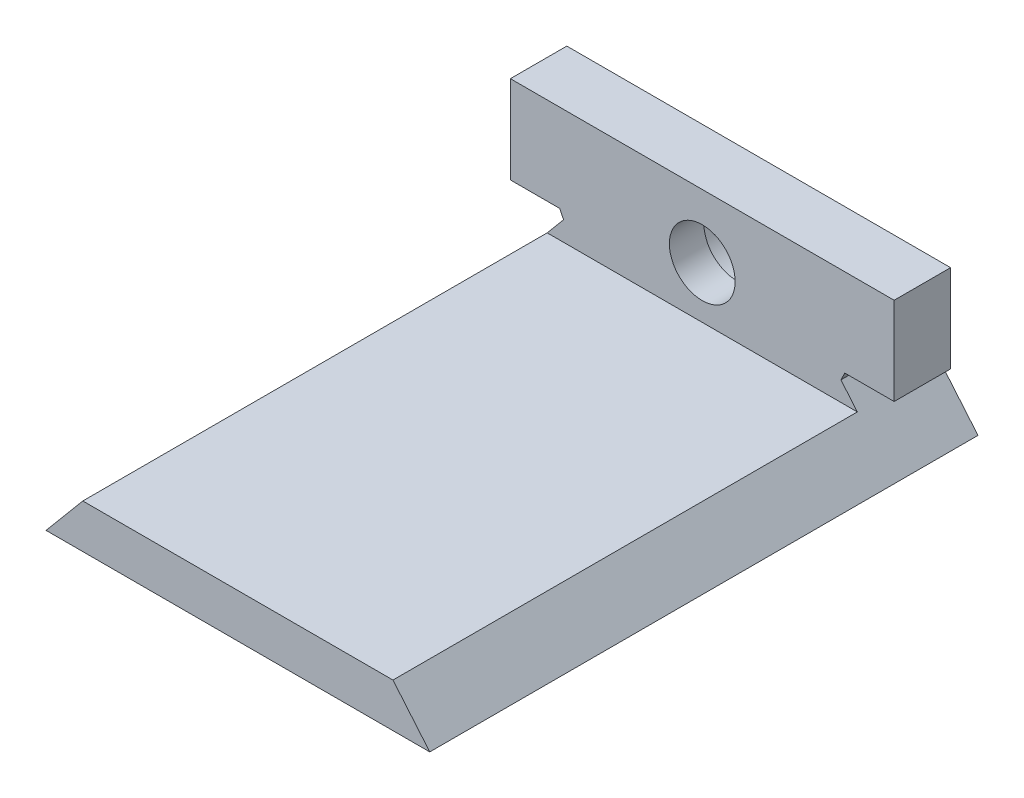
from build123d import *

# Parameters (mm, degrees)
EXTRUDE_1_DEPTH     = 70
CUT_EXTRUDE_1_DEPTH = 163
SKETCH_3_W          = 5
SKETCH_3_H          = 28.984249348
CUT_EXTRUDE_2_DEPTH = 74.198677084
SKETCH_4_W          = 20.259313124
SKETCH_4_H          = 10.192966915
CUT_EXTRUDE_3_DEPTH = 77.198677084
SKETCH_5_W          = 22.578654877
SKETCH_5_H          = 21
CUT_EXTRUDE_4_DEPTH = 77
SKETCH_7_R          = 6
CUT_EXTRUDE_5_DEPTH = 37
SKETCH_8_R          = 8
CUT_EXTRUDE_6_DEPTH = 4


with BuildPart() as part:
    # Эскиз1 → Бобышка-Вытянуть1 (new body)
    with BuildSketch(Plane(origin=(0, 0, 0), x_dir=(0, 0, -1), z_dir=(1, 0, 0))):
        with BuildLine():
            Line((-20.986257223, 0), (79.013742777, 0))
            Line((79.013742777, 0), (79.013742777, 32))
            ThreePointArc((79.013742777, 32), (77.549276683, 35.535533906), (74.013742777, 37))
            Line((74.013742777, 37), (71.922596638, 37))
            ThreePointArc((71.922596638, 37), (69.613853571, 36.435054166), (67.826836416, 34.867882182))
            Line((67.826836416, 34.867882182), (49.013742777, 8))
            Line((49.013742777, 8), (-20.986257223, 8))
            Line((-20.986257223, 8), (-20.986257223, 0))
        make_face()
    extrude(amount=EXTRUDE_1_DEPTH)

    # Эскиз2 → Вырез-Вытянуть1 (cut)
    with BuildSketch(Plane(origin=(0, 0, -79.013742777), x_dir=(-1, 0, 0), z_dir=(0, 0, -1))):
        Polygon((-61, 13), (-70, 13), (-70, 0), (-60.293754471, 11.56745298), align=None)
        Polygon((-9, 13), (-9.706245529, 11.56745298), (0, 0), (0, 13), align=None)
    extrude(amount=-CUT_EXTRUDE_1_DEPTH, mode=Mode.SUBTRACT)

    # Эскиз3 → Вырез-Вытянуть2 (cut)
    with BuildSketch(Plane.ZY):
        with Locations((-76.513742777, 24.492124674)):
            Rectangle(SKETCH_3_W, SKETCH_3_H)
    extrude(amount=-CUT_EXTRUDE_2_DEPTH, mode=Mode.SUBTRACT)

    # Эскиз4 → Вырез-Вытянуть3 (cut)
    with BuildSketch(Plane.ZY):
        with Locations((-65.118798198, 34.096483457)):
            Rectangle(SKETCH_4_W, SKETCH_4_H)
    extrude(amount=-CUT_EXTRUDE_3_DEPTH, mode=Mode.SUBTRACT)

    # Эскиз5 → Вырез-Вытянуть4 (cut)
    with BuildSketch(Plane(origin=(70, 0, 0), x_dir=(0, 0, -1), z_dir=(1, 0, 0))):
        with Locations((52.428773641, 18.5)):
            Rectangle(SKETCH_5_W, SKETCH_5_H)
    extrude(amount=-CUT_EXTRUDE_4_DEPTH, mode=Mode.SUBTRACT)

    # Эскиз7 → Вырез-Вытянуть5 (cut)
    with BuildSketch(Plane(origin=(0, 0, -74.013742777), x_dir=(-1, 0, 0), z_dir=(0, 0, -1))):
        with Locations((-35, 17.436066506)):
            Circle(SKETCH_7_R)
    extrude(amount=-CUT_EXTRUDE_5_DEPTH, mode=Mode.SUBTRACT)

    # Эскиз8 → Вырез-Вытянуть6 (cut)
    with BuildSketch(Plane(origin=(0, 0, -74.013742777), x_dir=(-1, 0, 0), z_dir=(0, 0, -1))):
        with Locations((-35, 17.436066506)):
            Circle(SKETCH_8_R)
    extrude(amount=-CUT_EXTRUDE_6_DEPTH, mode=Mode.SUBTRACT)


solid = part.part
